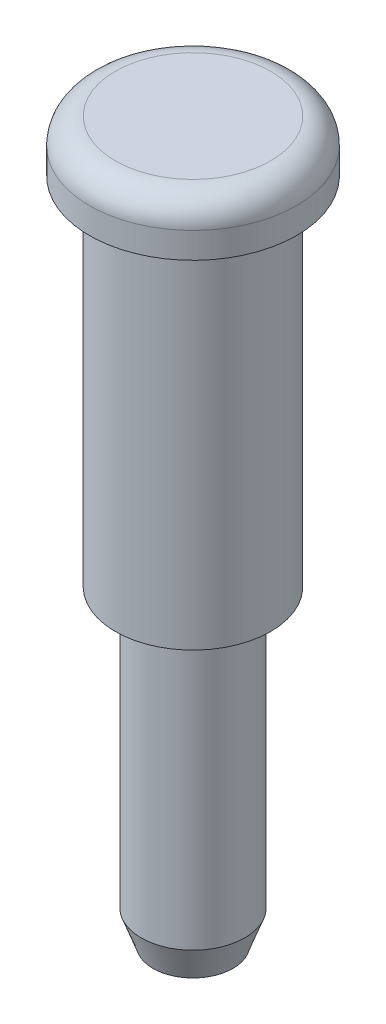
from build123d import *

# Parameters (mm, degrees)
FILETE1_R = 2


with BuildPart() as part:
    # Esboço1 → Revolução1 (revolve)
    with BuildSketch(Plane.XY):
        Polygon((0, 31.5), (8, 31.5), (8, 27.5), (6, 27.5), (6, 0), (4, 0), (4, -21.5), (3.090074414, -24), (0, -24), align=None)
    revolve(axis=Axis((0, -53.197951274, 0), (0, 1, 0)))

    # Filete1
    filete1_edges = [part.edges().sort_by_distance(p)[0] for p in [
        (-8, 31.5, 0),
    ]]
    fillet(filete1_edges, radius=FILETE1_R)


solid = part.part
